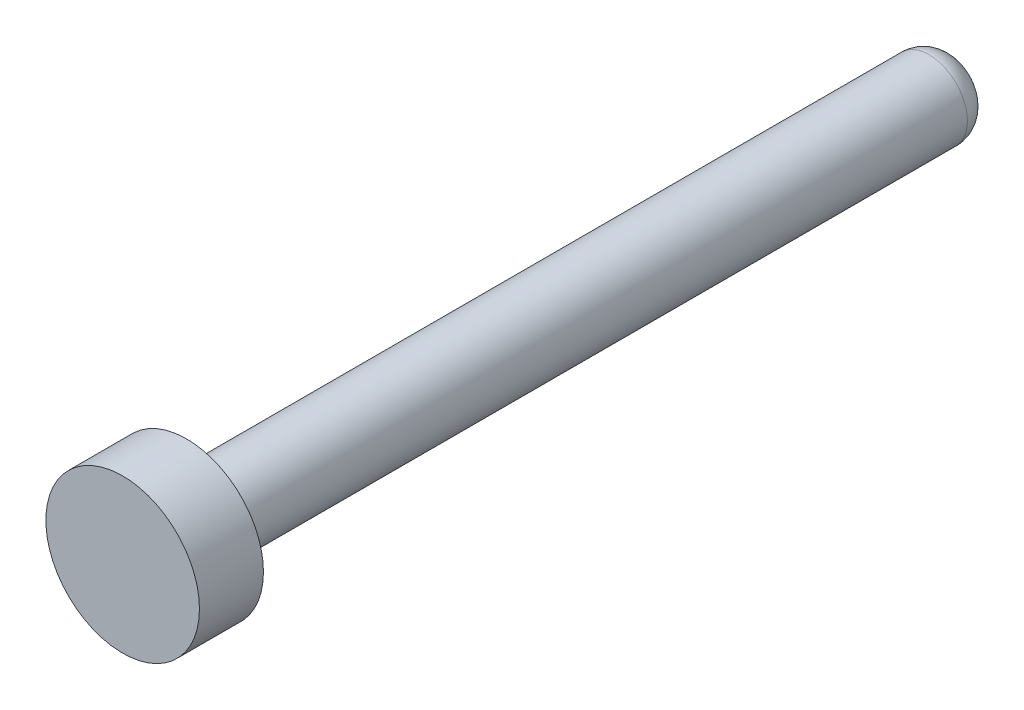
from build123d import *

# Parameters (mm, degrees)
SKETCH1_R           = 3
BOSS_EXTRUDE1_DEPTH = 65
SKETCH2_R           = 6
BOSS_EXTRUDE2_DEPTH = 5
FILLET1_R           = 2


with BuildPart() as part:
    # Sketch1 → Boss-Extrude1 (new body)
    with BuildSketch(Plane.XY):
        Circle(SKETCH1_R)
    extrude(amount=BOSS_EXTRUDE1_DEPTH)

    # Sketch2 → Boss-Extrude2 (add)
    with BuildSketch(Plane.XY.offset(65)):
        Circle(SKETCH2_R)
    extrude(amount=-BOSS_EXTRUDE2_DEPTH)

    # Fillet1
    fillet1_edges = [part.edges().sort_by_distance(p)[0] for p in [
        (-3, 0, 0),
    ]]
    fillet(fillet1_edges, radius=FILLET1_R)


solid = part.part
